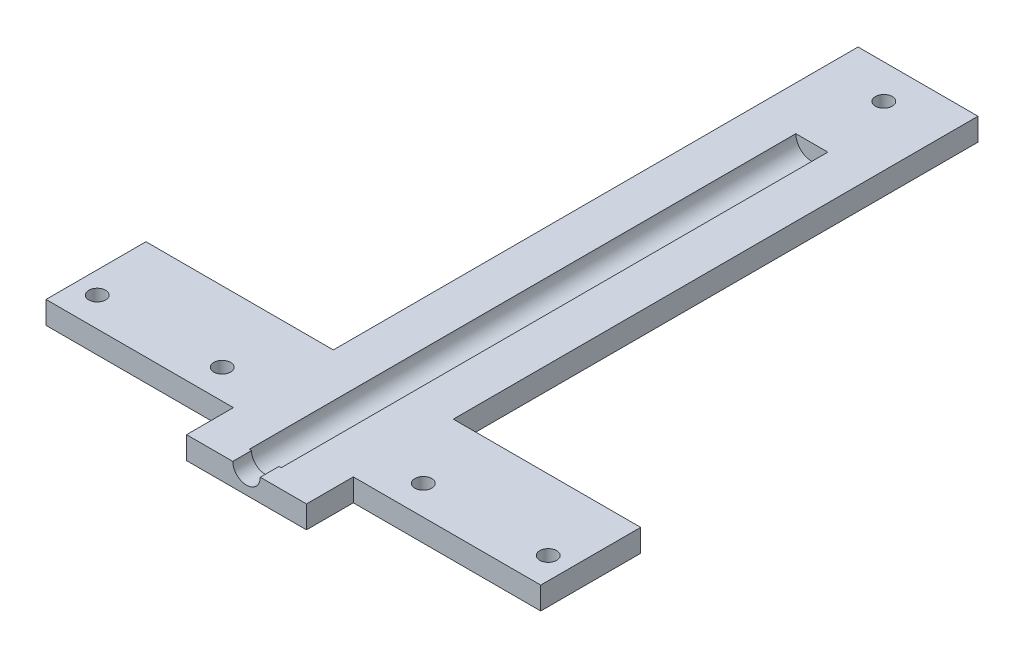
from build123d import *

# Parameters (mm, degrees)
SKETCH1_R           = 1.7145
BOSS_EXTRUDE1_DEPTH = 4.572
CUT_EXTRUDE1_DEPTH  = 3.81
CUT_EXTRUDE2_DEPTH  = 111.125


with BuildPart() as part:
    # Sketch1 → Boss-Extrude1 (new body)
    with BuildSketch(Plane(origin=(0, 0, 0), x_dir=(1, 0, 0), z_dir=(0, 1, 0))):
        Polygon((-4.445, 0), (0, 0), (0, 20.32), (-38.1, 20.32), (-38.1, 127), (-62.484, 127), (-62.484, 20.32), (-100.584, 20.32), (-100.584, 0), (-62.484, 0), (-62.484, -9.525), (-38.1, -9.525), (-38.1, 0), align=None)
        with Locations(Location((-96.139, 5.969, 0), (0, 0, 270))):
            Circle(SKETCH1_R, mode=Mode.SUBTRACT)
        with Locations(Location((-70.739, 5.969, 0), (0, 0, 270))):
            Circle(SKETCH1_R, mode=Mode.SUBTRACT)
        with Locations(Location((-29.845, 5.969, 0), (0, 0, 270))):
            Circle(SKETCH1_R, mode=Mode.SUBTRACT)
        with Locations(Location((-4.445, 5.969, 0), (0, 0, 270))):
            Circle(SKETCH1_R, mode=Mode.SUBTRACT)
        with Locations(Location((-50.292, 120.0404, 0), (0, 0, 270))):
            Circle(SKETCH1_R, mode=Mode.SUBTRACT)
    extrude(amount=BOSS_EXTRUDE1_DEPTH)

    # Sketch2 → Cut-Extrude1 (cut)
    with BuildSketch(Plane.XY.offset(9.525)):
        with BuildLine():
            Line((-53.086, 4.572), (-47.498, 4.572))
            ThreePointArc((-47.498, 4.572), (-50.292, 1.778), (-53.086, 4.572))
        make_face()
    extrude(amount=-CUT_EXTRUDE1_DEPTH, mode=Mode.SUBTRACT)

    # Sketch3 → Cut-Extrude2 (cut)
    with BuildSketch(Plane.XY.offset(5.715)):
        with BuildLine():
            Line((-53.5432, 4.572), (-47.0408, 4.572))
            ThreePointArc((-47.0408, 4.572), (-50.292, 1.3208), (-53.5432, 4.572))
        make_face()
    extrude(amount=-CUT_EXTRUDE2_DEPTH, mode=Mode.SUBTRACT)


solid = part.part
